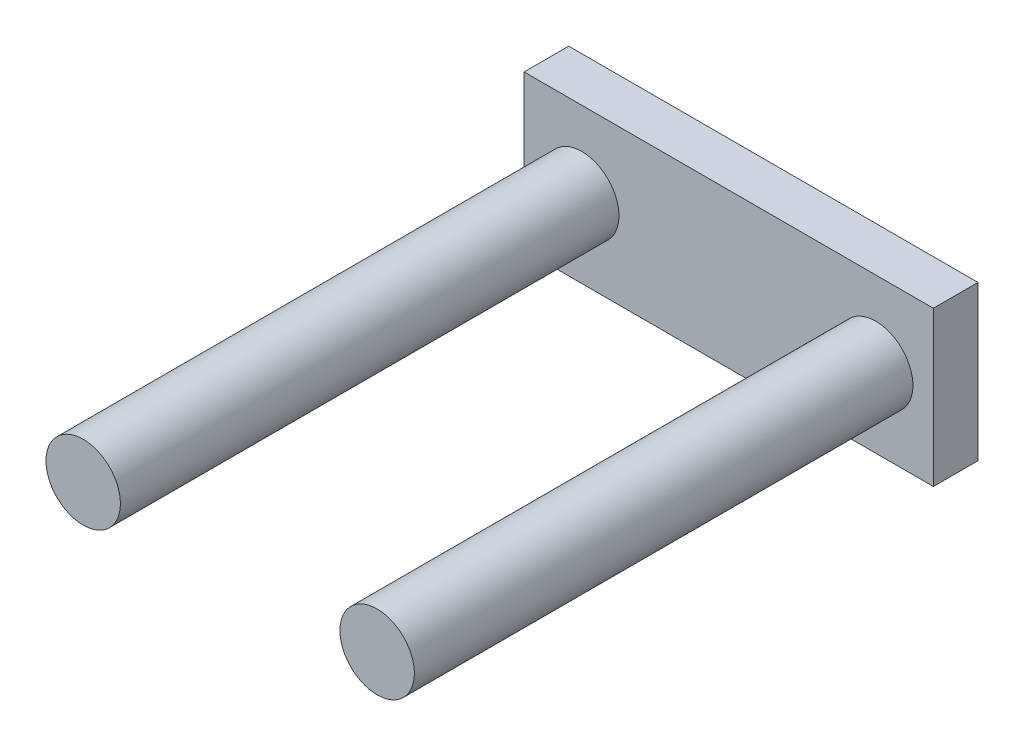
from build123d import *

# Parameters (mm, degrees)
CROQUIS1_W              = 110
CROQUIS1_H              = 41.5
SALIENTE_EXTRUIR1_DEPTH = 12
CROQUIS2_R              = 10
SALIENTE_EXTRUIR2_DEPTH = 134


with BuildPart() as part:
    # Croquis1 → Saliente-Extruir1 (new body)
    with BuildSketch(Plane.XY):
        Rectangle(CROQUIS1_W, CROQUIS1_H)
    extrude(amount=SALIENTE_EXTRUIR1_DEPTH)

    # Croquis2 → Saliente-Extruir2 (add)
    with BuildSketch(Plane.XY.offset(12)):
        with Locations(Location((-39.5, 0, 0), (0, 0, 180))):
            Circle(CROQUIS2_R)
        with Locations(Location((39.5, 0, 0), (0, 0, 180))):
            Circle(CROQUIS2_R)
    extrude(amount=SALIENTE_EXTRUIR2_DEPTH)


solid = part.part
